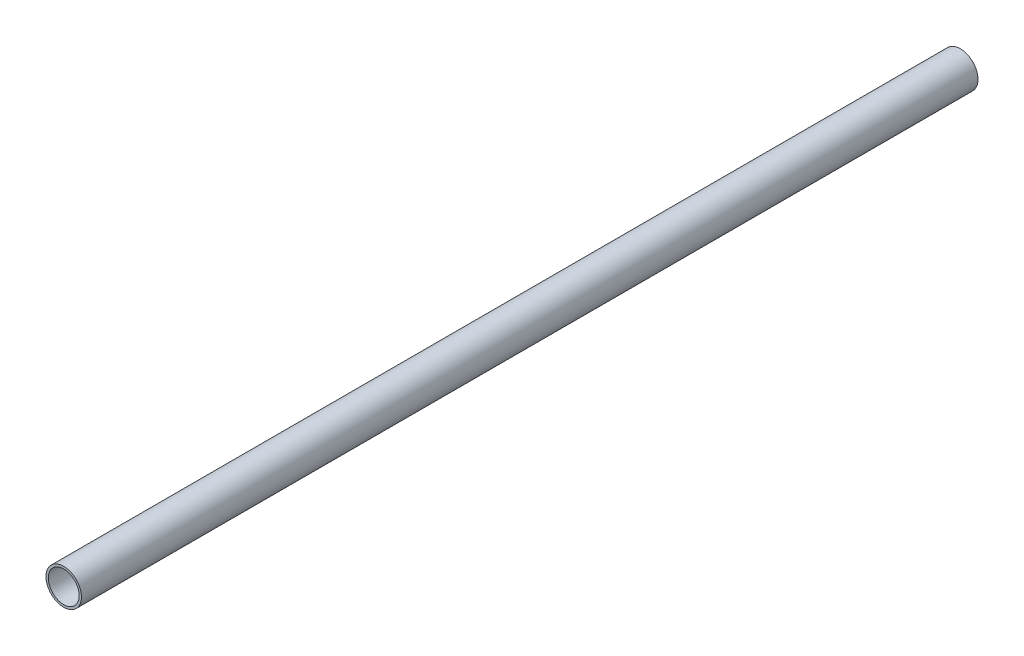
from build123d import *

# Parameters (mm, degrees)
SKETCH1_R           = 30.1625
SKETCH1_R_2         = 26.2509
BOSS_EXTRUDE1_DEPTH = 1524


with BuildPart() as part:
    # Sketch1 → Boss-Extrude1 (new body)
    with BuildSketch(Plane.XY):
        Circle(SKETCH1_R)
        Circle(SKETCH1_R_2, mode=Mode.SUBTRACT)
    extrude(amount=BOSS_EXTRUDE1_DEPTH)


solid = part.part
